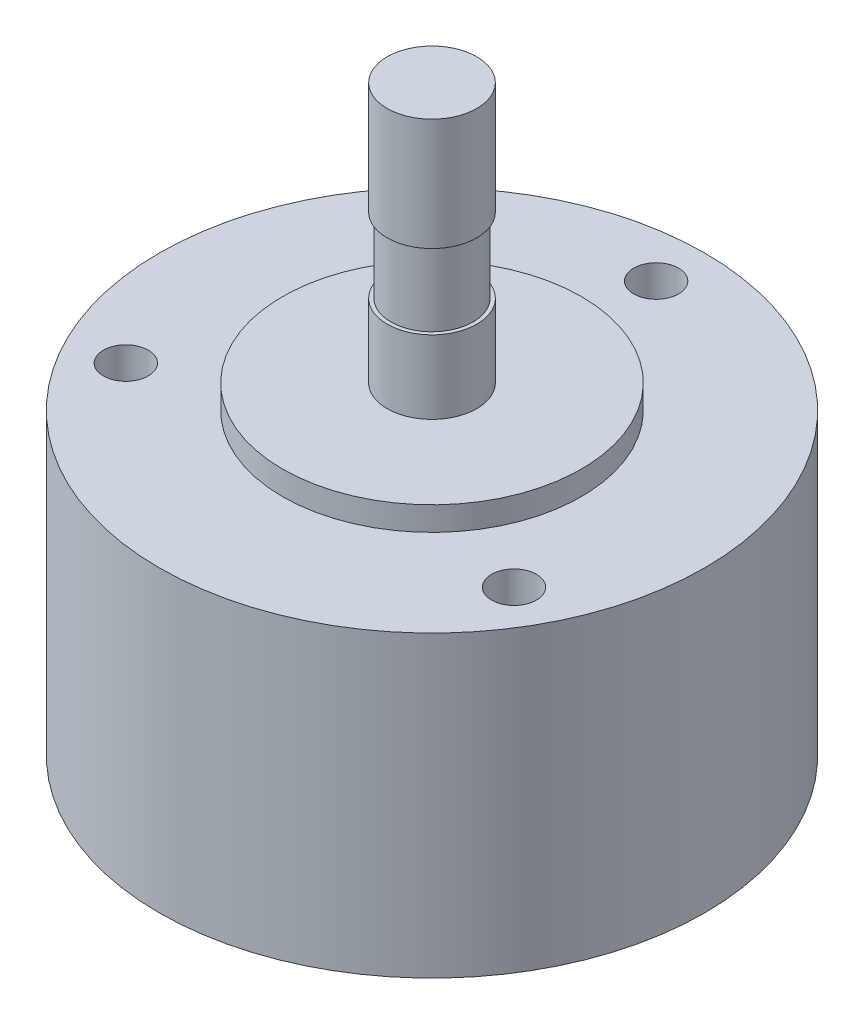
from build123d import *

# Parameters (mm, degrees)
SKETCH1_R           = 18.25
BOSS_EXTRUDE1_DEPTH = 20
SKETCH2_R           = 10
BOSS_EXTRUDE2_DEPTH = 1.6
SKETCH3_R           = 3
BOSS_EXTRUDE3_DEPTH = 17.4
SKETCH4_W           = 0.25
SKETCH4_H           = 5
CIRPATTERN1_COUNT   = 3


with BuildPart() as part:
    # Sketch1 → Boss-Extrude1 (new body)
    with BuildSketch(Plane(origin=(0, 0, 0), x_dir=(1, 0, 0), z_dir=(0, 1, 0))):
        with Locations(Location((0, 0, 0), (0, 0, 270))):
            Circle(SKETCH1_R)
    extrude(amount=BOSS_EXTRUDE1_DEPTH)

    # Sketch2 → Boss-Extrude2 (add)
    with BuildSketch(Plane(origin=(0, 20, 0), x_dir=(1, 0, 0), z_dir=(0, 1, 0))):
        with Locations(Location((0, 0, 0), (0, 0, 270))):
            Circle(SKETCH2_R)
    extrude(amount=BOSS_EXTRUDE2_DEPTH)

    # Sketch3 → Boss-Extrude3 (add)
    with BuildSketch(Plane(origin=(0, 21.6, 0), x_dir=(1, 0, 0), z_dir=(0, 1, 0))):
        with Locations(Location((0, 0, 0), (0, 0, 270))):
            Circle(SKETCH3_R)
    extrude(amount=BOSS_EXTRUDE3_DEPTH)

    # Sketch4 → Cut-Revolve1 (revolve, cut)
    with BuildSketch(Plane(origin=(0, 0, 0), x_dir=(0, 0, -1), z_dir=(1, 0, 0)), mode=Mode.PRIVATE) as cut_revolve1_sk:
        with Locations((2.875, 29)):
            Rectangle(SKETCH4_W, SKETCH4_H)
    revolve(cut_revolve1_sk.sketch.rotate(Axis((0, 39, 0), (0, -1, 0)), 180), axis=Axis((0, 39, 0), (0, -1, 0)), mode=Mode.SUBTRACT)

    # Sketch7 → Ø3.0mm Dowel Hole1 (revolve, cut)
    with BuildSketch(Plane(origin=(0, 20, -15), x_dir=(0, 0, 1), z_dir=(1, 0, 0))):
        Polygon((0, 0), (0, 6.901290929), (1.5, 6), (1.5, 0), align=None)
    f_3_0mm_dowel_hole1 = revolve(axis=Axis((0, 26.35, -15), (0, -1, 0)), mode=Mode.SUBTRACT)

    # CirPattern1: Ø3.0mm Dowel Hole1 ×3 about axis
    cirpattern1_axis = Axis((0, 0, 0), (0, 1, 0))
    for i in range(1, CIRPATTERN1_COUNT):
        add(f_3_0mm_dowel_hole1.rotate(cirpattern1_axis, i * 360 / CIRPATTERN1_COUNT), mode=Mode.SUBTRACT)


solid = part.part
